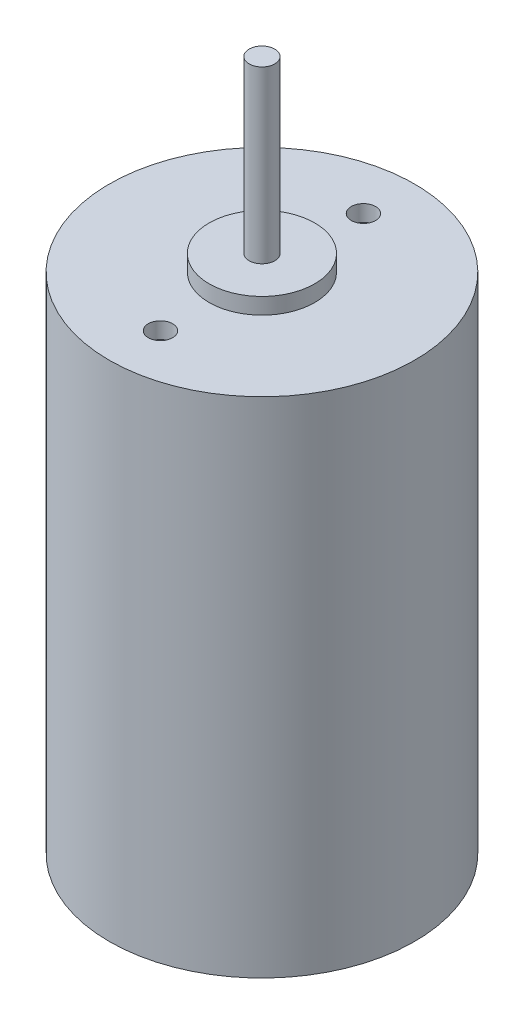
from build123d import *

# Parameters (mm, degrees)
SKETCH1_R           = 18.80108
BOSS_EXTRUDE1_DEPTH = 62
SKETCH2_R           = 1.58
BOSS_EXTRUDE2_DEPTH = 23
SKETCH3_R           = 1.5
CUT_EXTRUDE1_DEPTH  = 2
SKETCH4_R           = 6.5
BOSS_EXTRUDE3_DEPTH = 2


with BuildPart() as part:
    # Sketch1 → Boss-Extrude1 (new body)
    with BuildSketch(Plane(origin=(0, 0, 0), x_dir=(1, 0, 0), z_dir=(0, 1, 0))):
        with Locations(Location((0, 0, 0), (0, 0, 270))):
            Circle(SKETCH1_R)
    extrude(amount=-BOSS_EXTRUDE1_DEPTH)

    # Sketch2 → Boss-Extrude2 (add)
    with BuildSketch(Plane(origin=(0, 0, 0), x_dir=(1, 0, 0), z_dir=(0, 1, 0))):
        with Locations(Location((0, 0, 0), (0, 0, 270))):
            Circle(SKETCH2_R)
    extrude(amount=BOSS_EXTRUDE2_DEPTH)

    # Sketch3 → Cut-Extrude1 (cut)
    with BuildSketch(Plane(origin=(0, 0, 0), x_dir=(1, 0, 0), z_dir=(0, 1, 0))):
        with Locations(Location((0, 12.5, 0), (0, 0, 270))):
            Circle(SKETCH3_R)
        with Locations(Location((0, -12.5, 0), (0, 0, 270))):
            Circle(SKETCH3_R)
    extrude(amount=-CUT_EXTRUDE1_DEPTH, mode=Mode.SUBTRACT)

    # Sketch4 → Boss-Extrude3 (add)
    with BuildSketch(Plane(origin=(0, 0, 0), x_dir=(1, 0, 0), z_dir=(0, 1, 0))):
        with Locations(Location((0, 0, 0), (0, 0, 270))):
            Circle(SKETCH4_R)
    extrude(amount=BOSS_EXTRUDE3_DEPTH)


solid = part.part
